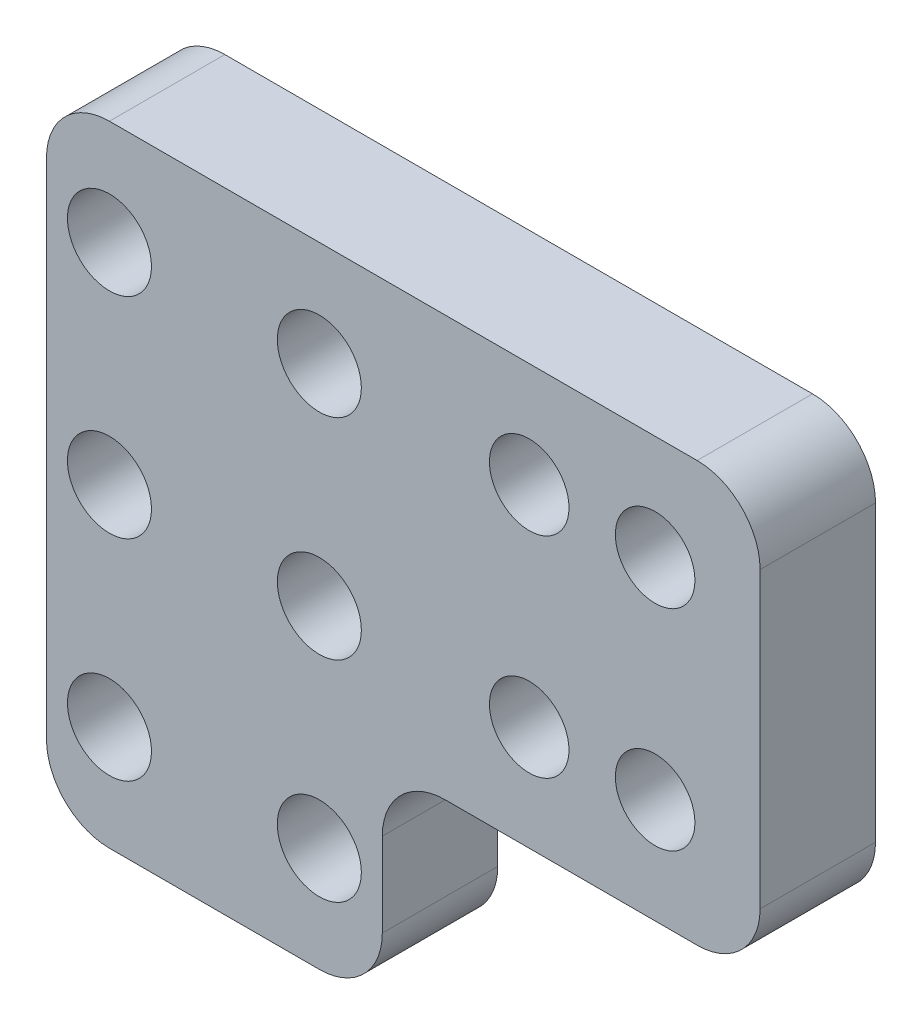
from build123d import *

# Parameters (mm, degrees)
SKETCH_1_R      = 2.001727574
SKETCH_1_R_2    = 1.895105282
EXTRUDE_1_DEPTH = 5.5
FILLET_1_R      = 3


with BuildPart() as part:
    # 草图1 → 凸台-拉伸1 (new body)
    with BuildSketch(Plane.XY):
        Polygon((-8, 15), (8, 15), (26, 15), (26, -5), (8, -5), (8, -15), (-8, -15), align=None)
        with Locations((-5, 10)):
            Circle(SKETCH_1_R, mode=Mode.SUBTRACT)
        with Locations((5, 10)):
            Circle(SKETCH_1_R, mode=Mode.SUBTRACT)
        with Locations((5, 0)):
            Circle(SKETCH_1_R, mode=Mode.SUBTRACT)
        with Locations((5, -10)):
            Circle(SKETCH_1_R, mode=Mode.SUBTRACT)
        with Locations((-5, 0)):
            Circle(SKETCH_1_R, mode=Mode.SUBTRACT)
        with Locations((-5, -10)):
            Circle(SKETCH_1_R, mode=Mode.SUBTRACT)
        with Locations((15, 10)):
            Circle(SKETCH_1_R_2, mode=Mode.SUBTRACT)
        with Locations((21, 10)):
            Circle(SKETCH_1_R_2, mode=Mode.SUBTRACT)
        with Locations((21, 0)):
            Circle(SKETCH_1_R_2, mode=Mode.SUBTRACT)
        with Locations((15, 0)):
            Circle(SKETCH_1_R_2, mode=Mode.SUBTRACT)
    extrude(amount=EXTRUDE_1_DEPTH)

    # 圆角1
    fillet_1_edges = [part.edges().sort_by_distance(p)[0] for p in [
        (8, -15, 2.75),
        (-8, -15, 2.75),
        (-8, 15, 2.75),
        (26, 15, 2.75),
        (26, -5, 2.75),
        (8, -5, 2.75),
    ]]
    fillet(fillet_1_edges, radius=FILLET_1_R)


solid = part.part
